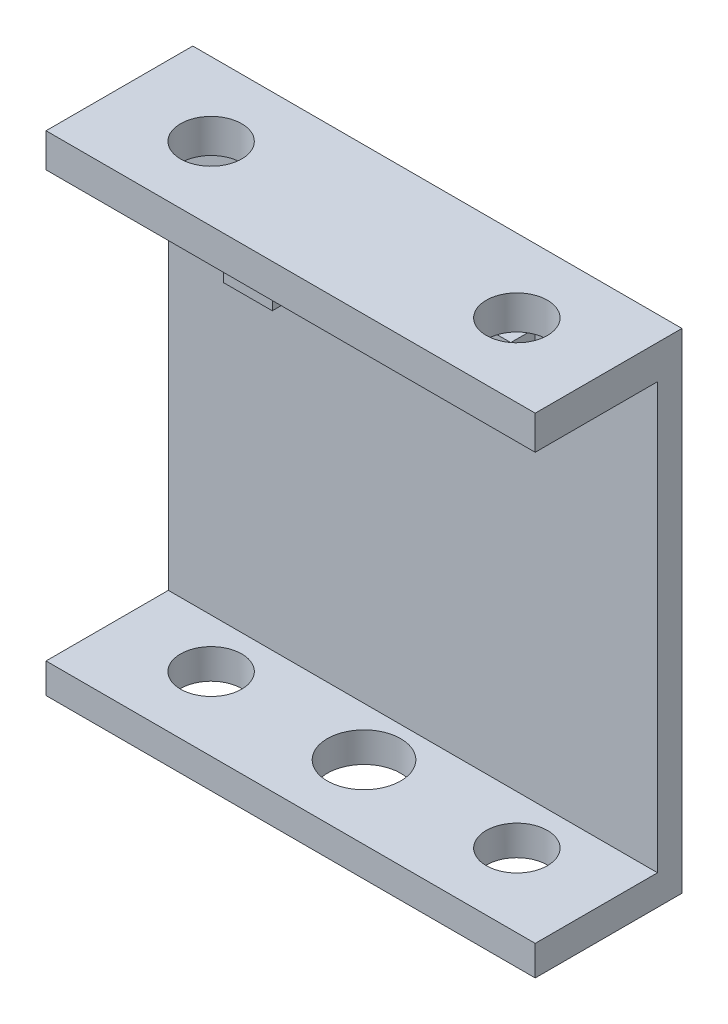
from build123d import *

# Parameters (mm, degrees)
SKETCH_2_W          = 40
SKETCH_2_H          = 40
EXTRUDE_1_DEPTH     = 12
SKETCH_3_R          = 2.5
CUT_EXTRUDE_1_DEPTH = 58.827329179
SKETCH_4_W          = 40
SKETCH_4_H          = 34.775319462
CUT_EXTRUDE_2_DEPTH = 10
SKETCH_6_R          = 3
CUT_EXTRUDE_3_DEPTH = 10
SKETCH_7_W          = 4
SKETCH_7_H          = 4
EXTRUDE_2_DEPTH     = 2
SKETCH_7_3_W        = 4
SKETCH_7_3_H        = 4
EXTRUDE_3_DEPTH     = 5.5


with BuildPart() as part:
    # 스케치2 → 보스-돌출1 (new body)
    with BuildSketch(Plane.XY):
        with Locations((20, -20)):
            Rectangle(SKETCH_2_W, SKETCH_2_H)
    extrude(amount=EXTRUDE_1_DEPTH)

    # 스케치3 → 컷-돌출1 (cut, through all)
    with BuildSketch(Plane(origin=(0, 0, 0), x_dir=(1, 0, 0), z_dir=(0, 1, 0))):
        with Locations((7.5, -6)):
            Circle(SKETCH_3_R)
        with Locations((32.5, -6)):
            Circle(SKETCH_3_R)
    extrude(amount=-CUT_EXTRUDE_1_DEPTH, mode=Mode.SUBTRACT)

    # 스케치4 → 컷-돌출2 (cut)
    with BuildSketch(Plane.XY.offset(12)):
        with Locations((20, -20.159533284)):
            Rectangle(SKETCH_4_W, SKETCH_4_H)
    extrude(amount=-CUT_EXTRUDE_2_DEPTH, mode=Mode.SUBTRACT)

    # 스케치6 → 컷-돌출3 (cut)
    with BuildSketch(Plane.XZ.offset(40)):
        with Locations((20, 6)):
            Circle(SKETCH_6_R)
    extrude(amount=-CUT_EXTRUDE_3_DEPTH, mode=Mode.SUBTRACT)

    # 스케치7 → 보스-돌출2 (add)
    with BuildSketch(Plane.XY.offset(2)):
        with Locations((28, -6)):
            Rectangle(SKETCH_7_W, SKETCH_7_H)
    extrude(amount=EXTRUDE_2_DEPTH)

    # 스케치7<3> → 보스-돌출3 (add)
    with BuildSketch(Plane.XY.offset(2)):
        with Locations((12, -6)):
            Rectangle(SKETCH_7_3_W, SKETCH_7_3_H)
    extrude(amount=EXTRUDE_3_DEPTH)


solid = part.part
